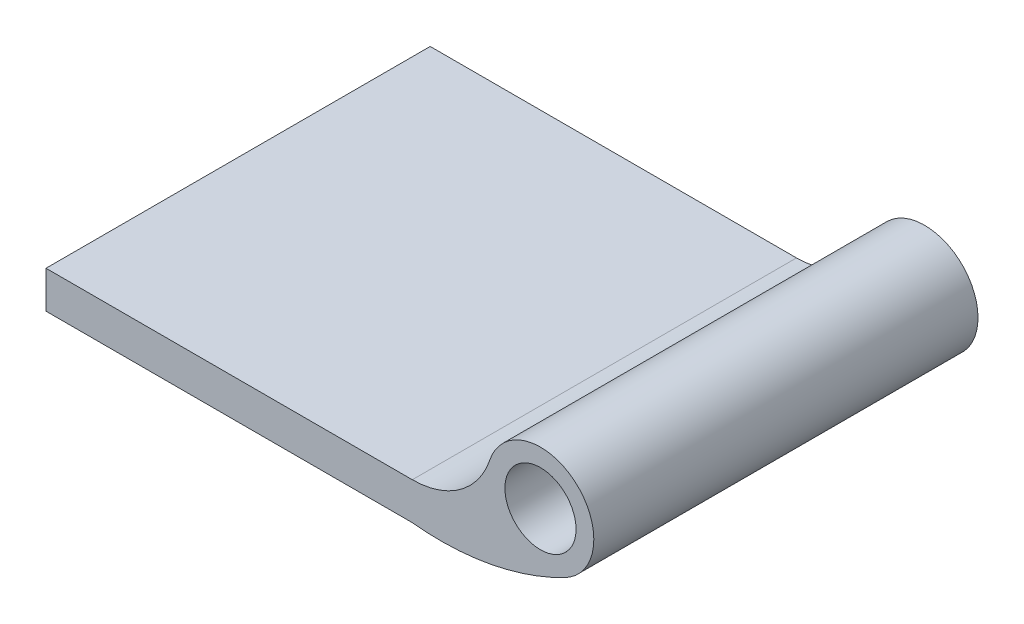
from build123d import *

# Parameters (mm, degrees)
SKETCH1_W           = 102.973663886
SKETCH1_H           = 10.457969277
SKETCH1_R           = 15
SKETCH1_R_2         = 10
BOSS_EXTRUDE1_DEPTH = 108


with BuildPart() as part:
    # Sketch1 → Boss-Extrude1 (new body)
    # profile 1 of 3: a face of its own
    with BuildSketch(Plane.XY):
        with Locations((-87.513168057, -16.191787915)):
            Rectangle(SKETCH1_W, SKETCH1_H)
    # profile 2 of 3: a face of its own
    with BuildSketch(Plane.XY):
        with BuildLine():
            Line((-36.026336114, -10.962803276), (-36.026336114, -21.420772553))
            ThreePointArc((-36.026336114, -21.420772553), (-13.958524045, -20.528091864), (6.914894743, -13.311056709))
            ThreePointArc((6.914894743, -13.311056709), (-9.740834476, -11.406846352), (-14.229640926, 4.745241735))
            ThreePointArc((-14.229640926, 4.745241735), (-22.592809035, -6.626630029), (-36.026336114, -10.962803276))
        make_face()
    # profile 3 of 3: a face of its own
    with BuildSketch(Plane.XY):
        Circle(SKETCH1_R)
        Circle(SKETCH1_R_2, mode=Mode.SUBTRACT)
    extrude(amount=BOSS_EXTRUDE1_DEPTH)


solid = part.part
